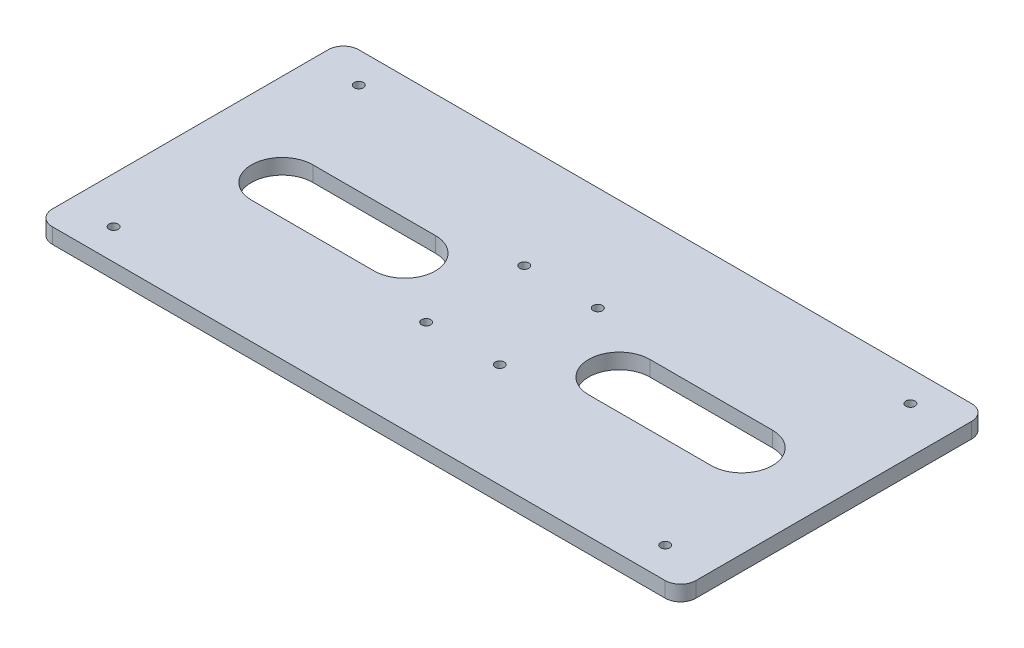
from build123d import *

# Parameters (mm, degrees)
SKETCH_1_W          = 210
SKETCH_1_H          = 100
EXTRUDE_1_DEPTH     = 5
CUT_EXTRUDE_1_DEPTH = 40
SKETCH_8_R          = 1.5
CUT_EXTRUDE_7_DEPTH = 5
FILLET_1_R          = 5
SKETCH_9_R          = 1.5
CUT_EXTRUDE_8_DEPTH = 233.647802483


with BuildPart() as part:
    # 草图1 → 凸台-拉伸1 (new body)
    with BuildSketch(Plane(origin=(0, 0, 0), x_dir=(1, 0, 0), z_dir=(0, 1, 0))):
        with Locations((105, -50)):
            Rectangle(SKETCH_1_W, SKETCH_1_H)
    extrude(amount=EXTRUDE_1_DEPTH)

    # 草图2 → 切除-拉伸1 (cut)
    with BuildSketch(Plane(origin=(0, 5, 0), x_dir=(1, 0, 0), z_dir=(0, 1, 0))):
        with BuildLine():
            Line((30, -40), (70, -40))
            ThreePointArc((70, -40), (80, -50), (70, -60))
            Line((70, -60), (30, -60))
            ThreePointArc((30, -60), (20, -50), (30, -40))
        make_face()
        with BuildLine():
            Line((140, -40), (180, -40))
            ThreePointArc((180, -40), (190, -50), (180, -60))
            Line((180, -60), (140, -60))
            ThreePointArc((140, -60), (130, -50), (140, -40))
        make_face()
    extrude(amount=-CUT_EXTRUDE_1_DEPTH, mode=Mode.SUBTRACT)

    # 草图8 → 切除-拉伸7 (cut)
    with BuildSketch(Plane(origin=(0, 5, 0), x_dir=(1, 0, 0), z_dir=(0, 1, 0))):
        with Locations(Location((15, -10, 0), (0, 0, 270))):
            Circle(SKETCH_8_R)
        with Locations(Location((15, -90, 0), (0, 0, 270))):
            Circle(SKETCH_8_R)
        with Locations(Location((195, -90, 0), (0, 0, 270))):
            Circle(SKETCH_8_R)
        with Locations(Location((195, -10, 0), (0, 0, 270))):
            Circle(SKETCH_8_R)
    extrude(amount=-CUT_EXTRUDE_7_DEPTH, mode=Mode.SUBTRACT)

    # 圆角1
    fillet_1_edges = [part.edges().sort_by_distance(p)[0] for p in [
        (0, 2.5, 0),
        (210, 2.5, 0),
        (210, 2.5, 100),
        (0, 2.5, 100),
    ]]
    fillet(fillet_1_edges, radius=FILLET_1_R)

    # 草图9 → 切除-拉伸8 (cut, through all)
    with BuildSketch(Plane(origin=(0, 5, 0), x_dir=(1, 0, 0), z_dir=(0, 1, 0))):
        with Locations(Location((93, -34, 0), (0, 0, 270))):
            Circle(SKETCH_9_R)
        with Locations(Location((117, -34, 0), (0, 0, 90))):
            Circle(SKETCH_9_R)
        with Locations(Location((117, -66, 0), (0, 0, 270))):
            Circle(SKETCH_9_R)
        with Locations(Location((93, -66, 0), (0, 0, 90))):
            Circle(SKETCH_9_R)
    extrude(amount=-CUT_EXTRUDE_8_DEPTH, mode=Mode.SUBTRACT)


solid = part.part
